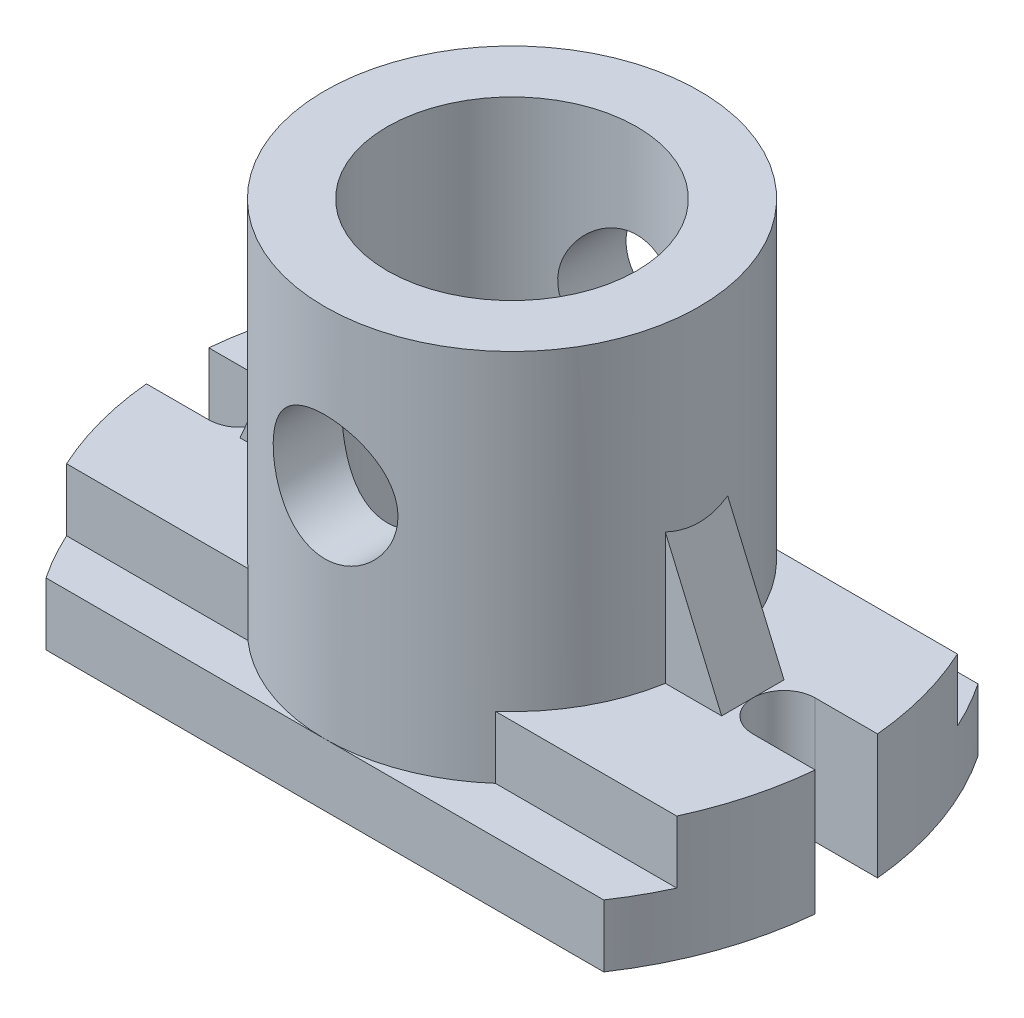
from build123d import *

# Parameters (mm, degrees)
EXTRUDE_1_DEPTH          = 10
SKETCH_3_R               = 30
EXTRUDE_2_DEPTH          = 60
CUT_EXTRUDE_START        = -30
SKETCH_4_R               = 10
CUT_EXTRUDE_1_DEPTH      = 60
EXTRUDE_3_DEPTH          = 10
CUT_EXTRUDE_2_DEPTH      = 94.134165377
CUT_EXTRUDE_2_DEPTH_BACK = 94.134165377
SKETCH_8_R               = 20
RIB_2_REACH              = 95.134
SKETCH_9_WALL_W          = 210.033760752
SKETCH_9_WALL_H          = 10


with BuildPart() as part:
    # 草图2 → 凸台-拉伸1 (new body)
    with BuildSketch(Plane(origin=(0, 0, 0), x_dir=(1, 0, 0), z_dir=(0, 1, 0))):
        with BuildLine():
            Line((53.609446504, 5), (43.609446504, 5))
            ThreePointArc((43.609446504, 5), (38.609446504, 0), (43.609446504, -5))
            Line((43.609446504, -5), (53.609446504, -5))
            ThreePointArc((53.609446504, -5), (50.723980057, -18.056871313), (44.709873121, -30))
            Line((44.709873121, -30), (-44.709873121, -30))
            ThreePointArc((-44.709873121, -30), (-50.723980057, -18.056871313), (-53.609446504, -5))
            Line((-53.609446504, -5), (-43.609446504, -5))
            ThreePointArc((-43.609446504, -5), (-38.609446504, 0), (-43.609446504, 5))
            Line((-43.609446504, 5), (-53.609446504, 5))
            ThreePointArc((-53.609446504, 5), (-50.723980057, 18.056871313), (-44.709873121, 30))
            Line((-44.709873121, 30), (44.709873121, 30))
            ThreePointArc((44.709873121, 30), (50.723980057, 18.056871313), (53.609446504, 5))
        make_face()
    extrude(amount=EXTRUDE_1_DEPTH)

    # 草图3 → 凸台-拉伸2 (add)
    with BuildSketch(Plane(origin=(0, 10, 0), x_dir=(1, 0, 0), z_dir=(0, 1, 0))):
        with Locations(Location((0, 0, 0), (0, 0, 270))):
            Circle(SKETCH_3_R)
    extrude(amount=EXTRUDE_2_DEPTH)

    # 草图4 → 切除-拉伸1 (cut)
    with BuildSketch(Plane.XY.offset(CUT_EXTRUDE_START)):
        with Locations(Location((0, 45, 0), (0, 0, 90))):
            Circle(SKETCH_4_R)
    extrude(amount=CUT_EXTRUDE_1_DEPTH, mode=Mode.SUBTRACT)

    # 草图7 → 凸台-拉伸3 (add)
    with BuildSketch(Plane(origin=(0, 10, 0), x_dir=(1, 0, 0), z_dir=(0, 1, 0))):
        with BuildLine():
            Line((-48.915465391, -22.5), (-19.843134833, -22.5))
            ThreePointArc((-19.843134833, -22.5), (-30, 0), (-19.843134833, 22.5))
            Line((-19.843134833, 22.5), (-48.915465391, 22.5))
            ThreePointArc((-48.915465391, 22.5), (-52.003864181, 13.948866071), (-53.609446504, 5))
            Line((-53.609446504, 5), (-43.609446504, 5))
            ThreePointArc((-43.609446504, 5), (-38.609446504, 0), (-43.609446504, -5))
            Line((-43.609446504, -5), (-53.609446504, -5))
            ThreePointArc((-53.609446504, -5), (-52.003864181, -13.948866071), (-48.915465391, -22.5))
        make_face()
        with BuildLine():
            Line((19.843134833, -22.5), (48.915465391, -22.5))
            ThreePointArc((48.915465391, -22.5), (52.003864181, -13.948866071), (53.609446504, -5))
            Line((53.609446504, -5), (43.609446504, -5))
            ThreePointArc((43.609446504, -5), (38.609446504, 0), (43.609446504, 5))
            Line((43.609446504, 5), (53.609446504, 5))
            ThreePointArc((53.609446504, 5), (52.003864181, 13.948866071), (48.915465391, 22.5))
            Line((48.915465391, 22.5), (19.843134833, 22.5))
            ThreePointArc((19.843134833, 22.5), (30, 0), (19.843134833, -22.5))
        make_face()
    extrude(amount=EXTRUDE_3_DEPTH)

    # 草图8 → 切除-拉伸2 (cut, two sides: drawn at the far end of the back side and taken through both)
    with BuildSketch(Plane(origin=(0, 70, 0), x_dir=(1, 0, 0), z_dir=(0, 1, 0)).offset(-CUT_EXTRUDE_2_DEPTH_BACK)):
        with Locations(Location((0, 0, 0), (0, 0, 270))):
            Circle(SKETCH_8_R)
    extrude(amount=CUT_EXTRUDE_2_DEPTH + CUT_EXTRUDE_2_DEPTH_BACK, mode=Mode.SUBTRACT)

    # 草图9 wall → 筋2 (add, up to next)
    with BuildSketch(Plane(origin=(34.316023147, 30, 0), x_dir=(0.394517672004, -0.918888353651, 0), z_dir=(0.918888353651, 0.394517672004, 0)), mode=Mode.PRIVATE) as rib_2_sk1:
        Rectangle(SKETCH_9_WALL_W, SKETCH_9_WALL_H)
    rib_2_tool1 = extrude(rib_2_sk1.sketch, amount=-RIB_2_REACH, mode=Mode.PRIVATE) - part.part
    rib_2 = rib_2_tool1.solids().sort_by_distance((34.316023147, 30, 0))[0]
    add(rib_2)

    # 镜向1: 筋2 across plane
    add(rib_2.mirror(Plane(origin=(0, 0, 0), x_dir=(0, 0, 1), z_dir=(1, 0, 0))))


solid = part.part
